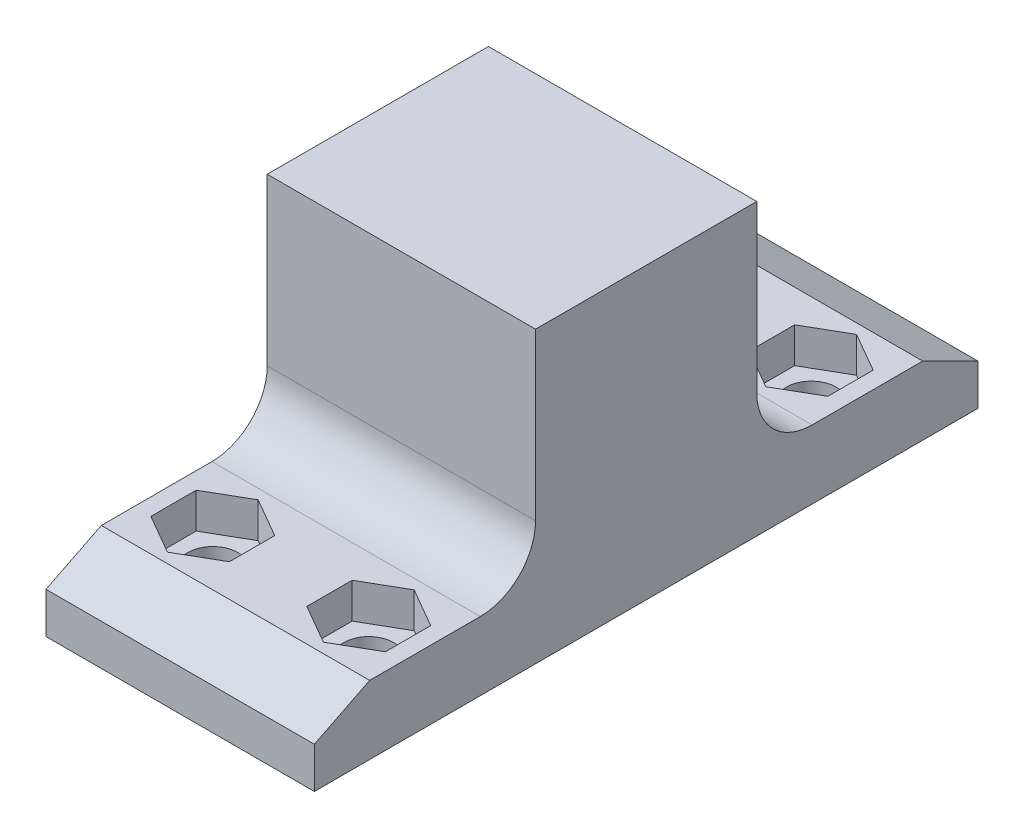
from build123d import *

# Parameters (mm, degrees)
SKETCH_1_W          = 24.26
SKETCH_1_H          = 6.2
EXTRUDE_1_DEPTH     = 60
CUT_EXTRUDE_1_DEPTH = 3.2
HOLE_WIZARD_M41_D   = 4.5
EXTRUDE_2_DEPTH     = 24.26
CHAMFER_1_SIZE      = 2.5
CHAMFER_1_SIZE2     = 5
CHAMFER_2_SIZE      = 5
CHAMFER_2_SIZE2     = 2.5


with BuildPart() as part:
    # Эскиз1 → Бобышка-Вытянуть1 (new body)
    with BuildSketch(Plane.XY):
        with Locations((12.13, 3.1)):
            Rectangle(SKETCH_1_W, SKETCH_1_H)
    extrude(amount=EXTRUDE_1_DEPTH)

    # Эскиз2 → Вырез-Вытянуть1 (cut)
    with BuildSketch(Plane(origin=(0, 6.2, 0), x_dir=(1, 0, 0), z_dir=(0, 1, 0))):
        Polygon((1.53, -47.950406544), (1.53, -52.049593456), (5.08, -54.099186911), (8.63, -52.049593456), (8.63, -47.950406544), (5.08, -45.900813089), align=None)
        Polygon((15.63, -47.950406544), (15.63, -52.049593456), (19.18, -54.099186911), (22.73, -52.049593456), (22.73, -47.950406544), (19.18, -45.900813089), align=None)
        Polygon((15.63, -7.950406544), (15.63, -12.049593456), (19.18, -14.099186911), (22.73, -12.049593456), (22.73, -7.950406544), (19.18, -5.900813089), align=None)
        Polygon((5.08, -14.099186911), (8.63, -12.049593456), (8.63, -7.950406544), (5.08, -5.900813089), (1.53, -7.950406544), (1.53, -12.049593456), align=None)
    extrude(amount=-CUT_EXTRUDE_1_DEPTH, mode=Mode.SUBTRACT)

    # Отверстие с зазором M41 (through all)
    with Locations(Plane(origin=(5.08, 3, 50), x_dir=(0, 0, 1), z_dir=(0, 1, 0))):
        with Locations((0, 0), (0, 14.1), (-40, 0), (-40, 14.1)):
            Hole(HOLE_WIZARD_M41_D / 2)

    # Эскиз6 → Бобышка-Вытянуть2 (add)
    with BuildSketch(Plane.ZY):
        with BuildLine():
            Line((40, 26.2), (20, 26.2))
            Line((20, 26.2), (20, 11.2))
            ThreePointArc((20, 11.2), (18.535533906, 7.664466094), (15, 6.2))
            Line((15, 6.2), (45, 6.2))
            ThreePointArc((45, 6.2), (41.464466094, 7.664466094), (40, 11.2))
            Line((40, 11.2), (40, 26.2))
        make_face()
    extrude(amount=-EXTRUDE_2_DEPTH)

    # Фаска1
    chamfer_1_edges = [part.edges().sort_by_distance(p)[0] for p in [
        (12.13, 6.2, 0),
    ]]
    chamfer_1_side = [part.faces().sort_by_distance(p)[0] for p in [
        (12.13, 3.1, 0),
    ]]
    chamfer(chamfer_1_edges, length=CHAMFER_1_SIZE, length2=CHAMFER_1_SIZE2, reference=chamfer_1_side[0])

    # Фаска2
    chamfer_2_edges = [part.edges().sort_by_distance(p)[0] for p in [
        (12.13, 6.2, 60),
    ]]
    chamfer_2_side = [part.faces().sort_by_distance(p)[0] for p in [
        (12.13, 6.2, 53.289196352),
    ]]
    chamfer(chamfer_2_edges, length=CHAMFER_2_SIZE, length2=CHAMFER_2_SIZE2, reference=chamfer_2_side[0])


solid = part.part
